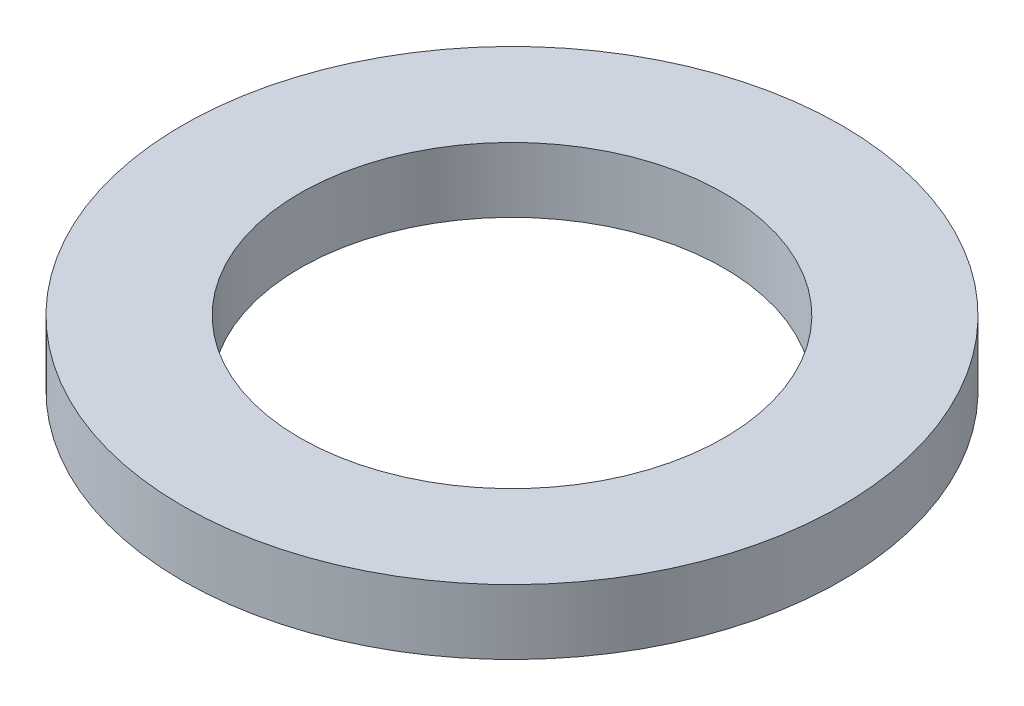
from build123d import *

# Parameters (mm, degrees)
SKETCH1_R           = 32.25
SKETCH1_R_2         = 20.75
BOSS_EXTRUDE1_DEPTH = 6.35


with BuildPart() as part:
    # Sketch1 → Boss-Extrude1 (new body)
    with BuildSketch(Plane(origin=(0, 0, 0), x_dir=(1, 0, 0), z_dir=(0, 1, 0))):
        with Locations(Location((0, 0, 0), (0, 0, 270))):
            Circle(SKETCH1_R)
        with Locations(Location((0, 0, 0), (0, 0, 270))):
            Circle(SKETCH1_R_2, mode=Mode.SUBTRACT)
    extrude(amount=BOSS_EXTRUDE1_DEPTH)


solid = part.part
